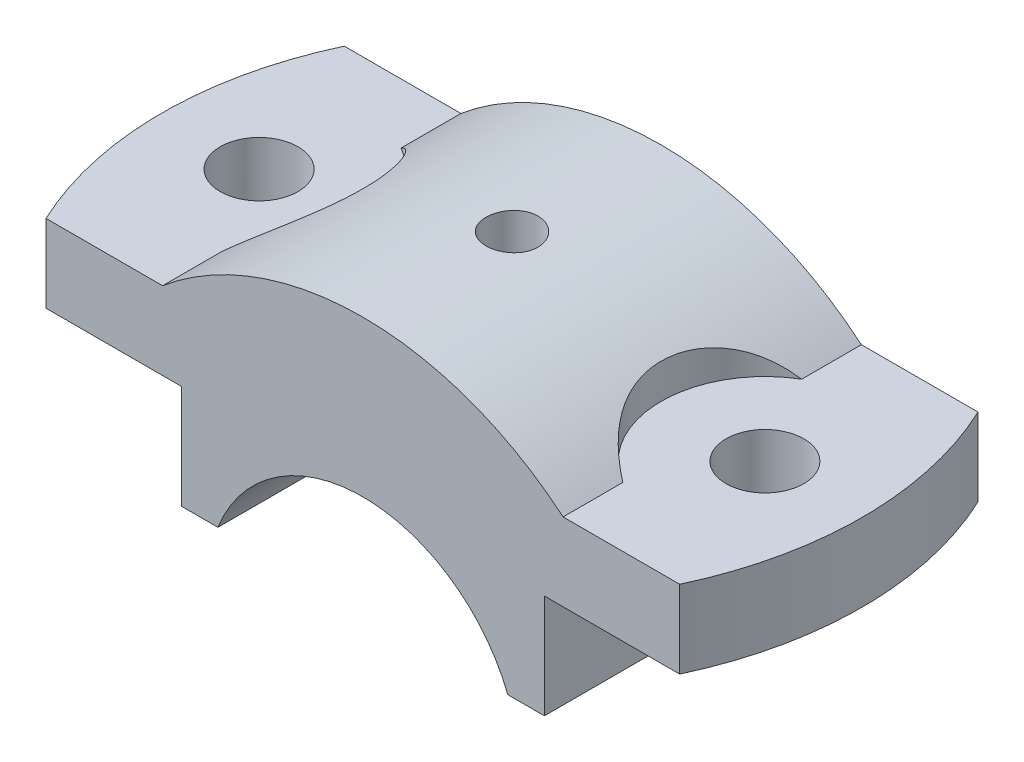
from build123d import *

# Parameters (mm, degrees)
BOSS_EXTRUDE1_DEPTH = 23
CUT_EXTRUDE1_DEPTH  = 46
SKETCH4_R           = 6
CUT_EXTRUDE2_DEPTH  = 46
CUT_EXTRUDE3_DEPTH  = 46
SKETCH6_R           = 4
CUT_EXTRUDE4_DEPTH  = 16
SKETCH7_R           = 3
CUT_EXTRUDE5_DEPTH  = 71.608515808


with BuildPart() as part:
    # Sketch1 → Boss-Extrude1 (new, symmetric)
    with BuildSketch(Plane.XY):
        with BuildLine():
            Line((-54, 3.825), (-30.877783275, 3.825))
            ThreePointArc((-30.877783275, 3.825), (0, 15.075), (30.877783275, 3.825))
            Line((30.877783275, 3.825), (54, 3.825))
            Line((54, 3.825), (54, -8.175))
            Line((54, -8.175), (28, -8.175))
            Line((28, -8.175), (28, -24.175))
            Line((28, -24.175), (22.348098353, -24.175))
            ThreePointArc((22.348098353, -24.175), (0, -8.925), (-22.348098353, -24.175))
            Line((-22.348098353, -24.175), (-28, -24.175))
            Line((-28, -24.175), (-28, -8.175))
            Line((-28, -8.175), (-54, -8.175))
            Line((-54, -8.175), (-54, 3.825))
        make_face()
    extrude(amount=BOSS_EXTRUDE1_DEPTH, both=True)

    # Sketch2 → Cut-Extrude1 (cut)
    with BuildSketch(Plane(origin=(0, 3.825, 0), x_dir=(1, 0, 0), z_dir=(0, 1, 0))):
        with BuildLine():
            ThreePointArc((48.856934001, -23), (54, 0), (48.856934001, 23))
            Line((48.856934001, 23), (54, 23))
            Line((54, 23), (85.001299568, 23))
            Line((85.001299568, 23), (85.001299568, -23))
            Line((85.001299568, -23), (54, -23))
            Line((54, -23), (48.856934001, -23))
        make_face()
        with BuildLine():
            Line((-48.856934001, 23), (-68.265292399, 23))
            Line((-68.265292399, 23), (-68.265292399, -23))
            Line((-68.265292399, -23), (-54, -23))
            Line((-54, -23), (-48.856934001, -23))
            ThreePointArc((-48.856934001, -23), (-54, 0), (-48.856934001, 23))
        make_face()
    extrude(amount=-CUT_EXTRUDE1_DEPTH, mode=Mode.SUBTRACT)

    # Sketch4 → Cut-Extrude2 (cut)
    with BuildSketch(Plane(origin=(0, 3.825, 0), x_dir=(1, 0, 0), z_dir=(0, 1, 0))):
        with Locations(Location((-39, 0, 0), (0, 0, 270))):
            Circle(SKETCH4_R)
        with Locations(Location((39, 0, 0), (0, 0, 270))):
            Circle(SKETCH4_R)
    extrude(amount=-CUT_EXTRUDE2_DEPTH, mode=Mode.SUBTRACT)

    # Sketch5 → Cut-Extrude3 (cut)
    with BuildSketch(Plane(origin=(0, 3.825, 0), x_dir=(1, 0, 0), z_dir=(0, 1, 0))):
        with BuildLine():
            Line((-30.877783275, 13.785122251), (-30.877783275, -13.785122251))
            ThreePointArc((-30.877783275, -13.785122251), (-23, 0), (-30.877783275, 13.785122251))
        make_face()
        with BuildLine():
            Line((30.877783275, 13.785122251), (30.877783275, -13.785122251))
            ThreePointArc((30.877783275, -13.785122251), (23, 0), (30.877783275, 13.785122251))
        make_face()
    extrude(amount=CUT_EXTRUDE3_DEPTH, mode=Mode.SUBTRACT)

    # Sketch6 → Cut-Extrude4 (cut)
    with BuildSketch(Plane(origin=(0, 15.075, 0), x_dir=(1, 0, 0), z_dir=(0, 1, 0))):
        with Locations(Location((0, 0, 0), (0, 0, 270))):
            Circle(SKETCH6_R)
    extrude(amount=-CUT_EXTRUDE4_DEPTH, mode=Mode.SUBTRACT)

    # Sketch7 → Cut-Extrude5 (cut, through all)
    with BuildSketch(Plane(origin=(0, 15.075, 0), x_dir=(1, 0, 0), z_dir=(0, 1, 0))):
        with Locations(Location((0, 0, 0), (0, 0, 270))):
            Circle(SKETCH7_R)
    extrude(amount=-CUT_EXTRUDE5_DEPTH, mode=Mode.SUBTRACT)


solid = part.part
